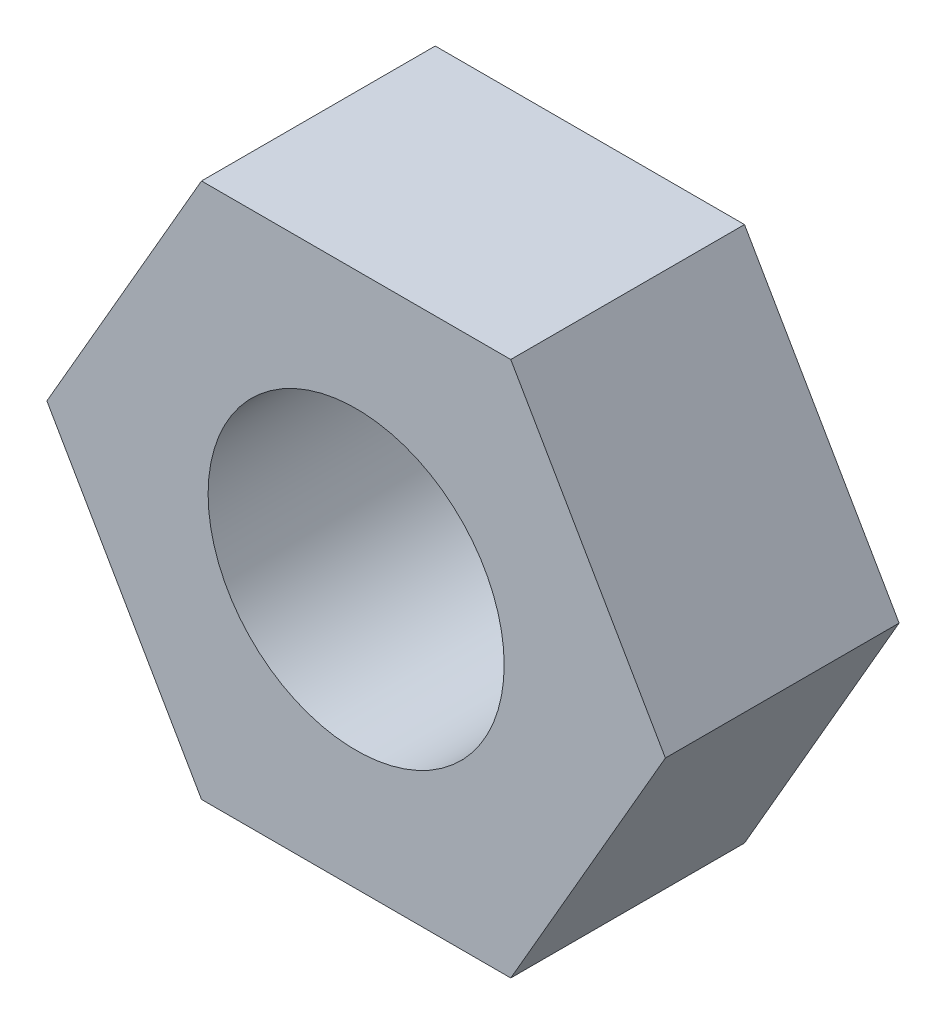
from build123d import *

# Parameters (mm, degrees)
HEX_BLANK_DEPTH                  = 2.4
NOMINAL_THREAD_ENVELOPE_START    = -1
SKETCH_NOMINAL_THREAD_ENVELOPE_R = 1.52
NOMINAL_THREAD_ENVELOPE_DEPTH    = 4.4


with BuildPart() as part:
    # Sketch_Hex_blank → Hex_blank (new body)
    with BuildSketch(Plane.XY):
        Polygon((3.175426481, 0), (1.58771324, 2.75), (-1.58771324, 2.75), (-3.175426481, 0), (-1.58771324, -2.75), (1.58771324, -2.75), align=None)
    extrude(amount=HEX_BLANK_DEPTH)

    # Sketch_Nominal_thread_envelope → Nominal_thread_envelope (cut)
    with BuildSketch(Plane.XY.offset(NOMINAL_THREAD_ENVELOPE_START)):
        Circle(SKETCH_NOMINAL_THREAD_ENVELOPE_R)
    extrude(amount=NOMINAL_THREAD_ENVELOPE_DEPTH, mode=Mode.SUBTRACT)


solid = part.part
